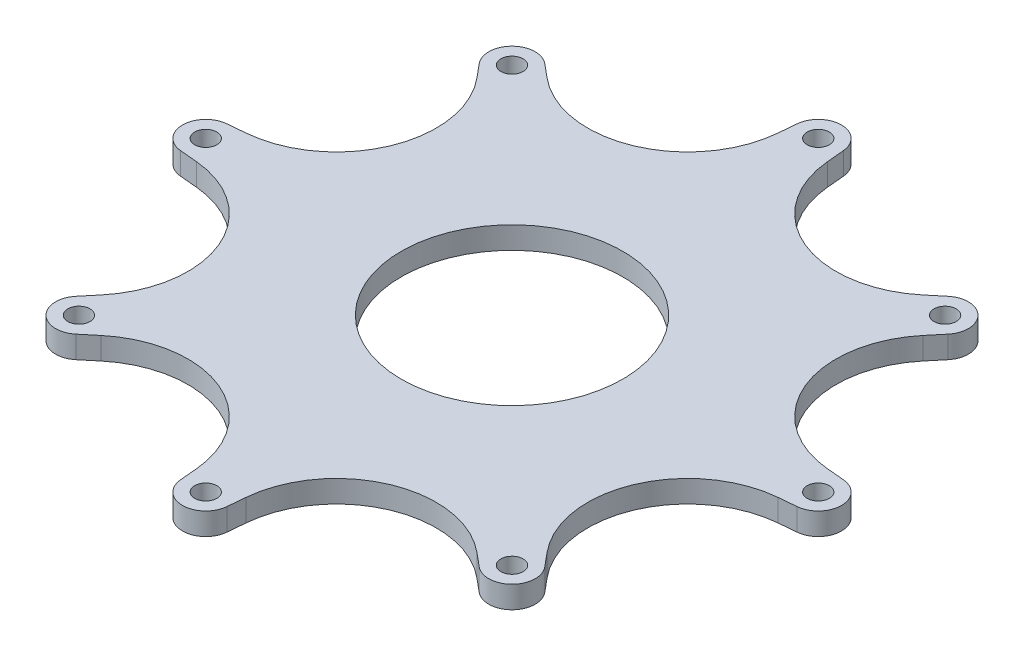
from build123d import *

# Parameters (mm, degrees)
SKETCH1_R           = 5.25
BOSS_EXTRUDE1_DEPTH = 5
SKETCH2_R           = 2.5
CUT_EXTRUDE1_DEPTH  = 10
SKETCH3_R           = 25
CUT_EXTRUDE2_DEPTH  = 10


with BuildPart() as part:
    # Sketch1 → Boss-Extrude1 (new body)
    with BuildSketch(Plane(origin=(0, 0, 0), x_dir=(1, 0, 0), z_dir=(0, 1, 0))):
        with BuildLine():
            ThreePointArc((69.572261498, -5.228532951), (63.847979746, 0), (69.572261498, 5.228532951))
            Line((69.572261498, 5.228532951), (65.565343666, 5.592001639))
            ThreePointArc((65.565343666, 5.592001639), (46.810690265, 19.389622772), (50.315841396, 42.407556838))
            Line((50.315841396, 42.407556838), (52.892148993, 45.497886783))
            ThreePointArc((52.892148993, 45.497886783), (45.147339444, 45.147339444), (45.497886783, 52.892148993))
            Line((45.497886783, 52.892148993), (42.407556838, 50.315841396))
            ThreePointArc((42.407556838, 50.315841396), (19.389622772, 46.810690265), (5.592001639, 65.565343666))
            Line((5.592001639, 65.565343666), (5.228532951, 69.572261498))
            ThreePointArc((5.228532951, 69.572261498), (5.244630492, 69.33536341), (5.25, 69.097979746))
            ThreePointArc((5.25, 69.097979746), (-0.237383663, 63.853349255), (-5.228532951, 69.572261498))
            Line((-5.228532951, 69.572261498), (-5.592001639, 65.565343666))
            ThreePointArc((-5.592001639, 65.565343666), (-19.389622772, 46.810690265), (-42.407556838, 50.315841396))
            Line((-42.407556838, 50.315841396), (-45.497886783, 52.892148993))
            ThreePointArc((-45.497886783, 52.892148993), (-44.105086073, 51.085997151), (-43.609650045, 48.859650045))
            ThreePointArc((-43.609650045, 48.859650045), (-47.071930755, 43.923400483), (-52.892148993, 45.497886783))
            Line((-52.892148993, 45.497886783), (-50.315841396, 42.407556838))
            ThreePointArc((-50.315841396, 42.407556838), (-46.44262448, 35.661654101), (-45.097979746, 28))
            ThreePointArc((-45.097979746, 28), (-50.984968102, 12.825750625), (-65.565343666, 5.592001639))
            Line((-65.565343666, 5.592001639), (-69.572261498, 5.228532951))
            ThreePointArc((-69.572261498, 5.228532951), (-65.557321559, 3.876369384), (-63.847979746, 0))
            ThreePointArc((-63.847979746, 0), (-65.557321559, -3.876369384), (-69.572261498, -5.228532951))
            Line((-69.572261498, -5.228532951), (-65.565343666, -5.592001639))
            ThreePointArc((-65.565343666, -5.592001639), (-50.984968102, -12.825750625), (-45.097979746, -28))
            ThreePointArc((-45.097979746, -28), (-46.44262448, -35.661654101), (-50.315841396, -42.407556838))
            Line((-50.315841396, -42.407556838), (-52.892148993, -45.497886783))
            ThreePointArc((-52.892148993, -45.497886783), (-47.071930755, -43.923400483), (-43.609650045, -48.859650045))
            ThreePointArc((-43.609650045, -48.859650045), (-44.105086073, -51.085997151), (-45.497886783, -52.892148993))
            Line((-45.497886783, -52.892148993), (-42.407556838, -50.315841396))
            ThreePointArc((-42.407556838, -50.315841396), (-19.389622772, -46.810690265), (-5.592001639, -65.565343666))
            Line((-5.592001639, -65.565343666), (-5.228532951, -69.572261498))
            ThreePointArc((-5.228532951, -69.572261498), (-0.237383663, -63.853349255), (5.25, -69.097979746))
            ThreePointArc((5.25, -69.097979746), (5.244630492, -69.33536341), (5.228532951, -69.572261498))
            Line((5.228532951, -69.572261498), (5.592001639, -65.565343666))
            ThreePointArc((5.592001639, -65.565343666), (19.389622772, -46.810690265), (42.407556838, -50.315841396))
            Line((42.407556838, -50.315841396), (45.497886783, -52.892148993))
            ThreePointArc((45.497886783, -52.892148993), (45.147339444, -45.147339444), (52.892148993, -45.497886783))
            Line((52.892148993, -45.497886783), (50.315841396, -42.407556838))
            ThreePointArc((50.315841396, -42.407556838), (46.810690265, -19.389622772), (65.565343666, -5.592001639))
            Line((65.565343666, -5.592001639), (69.572261498, -5.228532951))
        make_face()
        with Locations((0, -69.097979746)):
            Circle(SKETCH1_R)
        with Locations((48.859650045, -48.859650045)):
            Circle(SKETCH1_R)
        with Locations((69.097979746, 0)):
            Circle(SKETCH1_R)
        with Locations((48.859650045, 48.859650045)):
            Circle(SKETCH1_R)
        with Locations((-48.859650045, -48.859650045)):
            Circle(SKETCH1_R)
        with Locations((-69.097979746, 0)):
            Circle(SKETCH1_R)
        with Locations((-48.859650045, 48.859650045)):
            Circle(SKETCH1_R)
        with Locations((0, 69.097979746)):
            Circle(SKETCH1_R)
    extrude(amount=BOSS_EXTRUDE1_DEPTH)

    # Sketch2 → Cut-Extrude1 (cut)
    with BuildSketch(Plane(origin=(0, 5, 0), x_dir=(1, 0, 0), z_dir=(0, 1, 0))):
        with Locations(Location((69.097979746, 0, 0), (0, 0, 270))):
            Circle(SKETCH2_R)
        with Locations(Location((48.859650045, -48.859650045, 0), (0, 0, 270))):
            Circle(SKETCH2_R)
        with Locations(Location((0, -69.097979746, 0), (0, 0, 270))):
            Circle(SKETCH2_R)
        with Locations(Location((-48.859650045, -48.859650045, 0), (0, 0, 270))):
            Circle(SKETCH2_R)
        with Locations(Location((-69.097979746, 0, 0), (0, 0, 270))):
            Circle(SKETCH2_R)
        with Locations(Location((-48.859650045, 48.859650045, 0), (0, 0, 270))):
            Circle(SKETCH2_R)
        with Locations(Location((0, 69.097979746, 0), (0, 0, 270))):
            Circle(SKETCH2_R)
        with Locations(Location((48.859650045, 48.859650045, 0), (0, 0, 270))):
            Circle(SKETCH2_R)
    extrude(amount=-CUT_EXTRUDE1_DEPTH, mode=Mode.SUBTRACT)

    # Sketch3 → Cut-Extrude2 (cut)
    with BuildSketch(Plane(origin=(0, 5, 0), x_dir=(1, 0, 0), z_dir=(0, 1, 0))):
        with Locations(Location((0, 0, 0), (0, 0, 270))):
            Circle(SKETCH3_R)
    extrude(amount=-CUT_EXTRUDE2_DEPTH, mode=Mode.SUBTRACT)


solid = part.part
